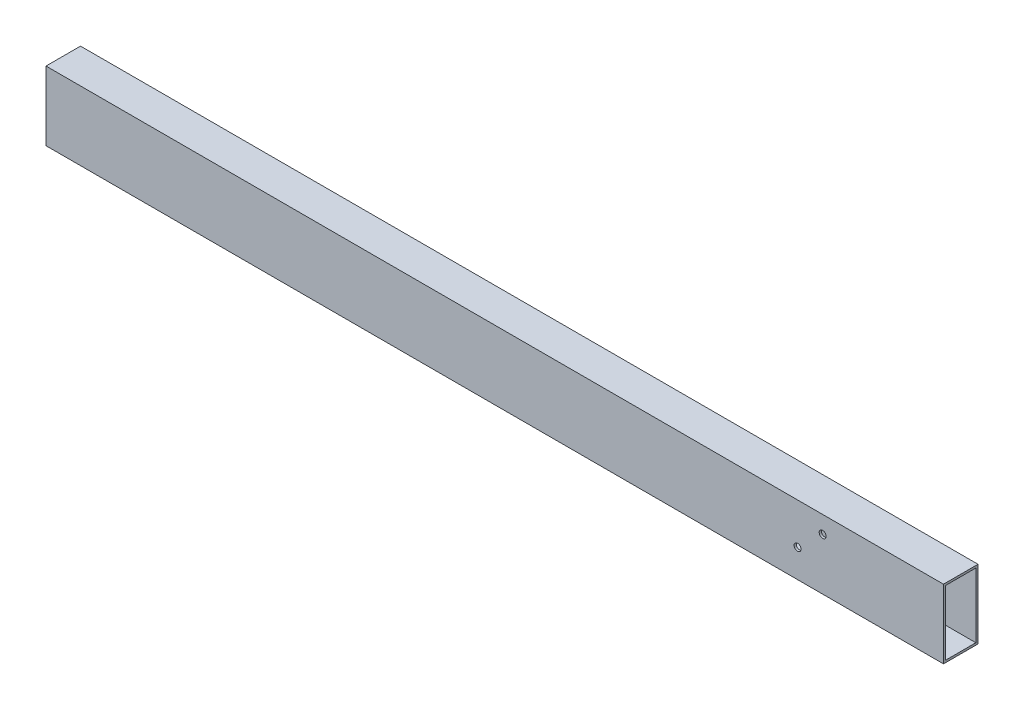
from build123d import *

# Parameters (mm, degrees)
SKETCH1_W              = 25.4
SKETCH1_H              = 50.8
SKETCH1_W_2            = 22.225
SKETCH1_H_2            = 47.625
BOSS_EXTRUDE1_DEPTH    = 330.2
F_10_CLEARANCE_HOLE1_D = 5.1054


with BuildPart() as part:
    # Sketch1 → Boss-Extrude1 (new, symmetric)
    with BuildSketch(Plane(origin=(0, 0, 0), x_dir=(0, 0, -1), z_dir=(1, 0, 0))):
        with Locations((1.923003206, 0)):
            Rectangle(SKETCH1_W, SKETCH1_H)
        with Locations((1.923003206, 0)):
            Rectangle(SKETCH1_W_2, SKETCH1_H_2, mode=Mode.SUBTRACT)
    extrude(amount=BOSS_EXTRUDE1_DEPTH, both=True)

    # #10 Clearance Hole1 (through all)
    with Locations(Plane(origin=(0, 0, -14.623003206), x_dir=(-1, 0, 0), z_dir=(0, 0, -1))):
        with Locations((-241.3, 12.7), (-222.832275442, -4.738553542)):
            Hole(F_10_CLEARANCE_HOLE1_D / 2)


solid = part.part
